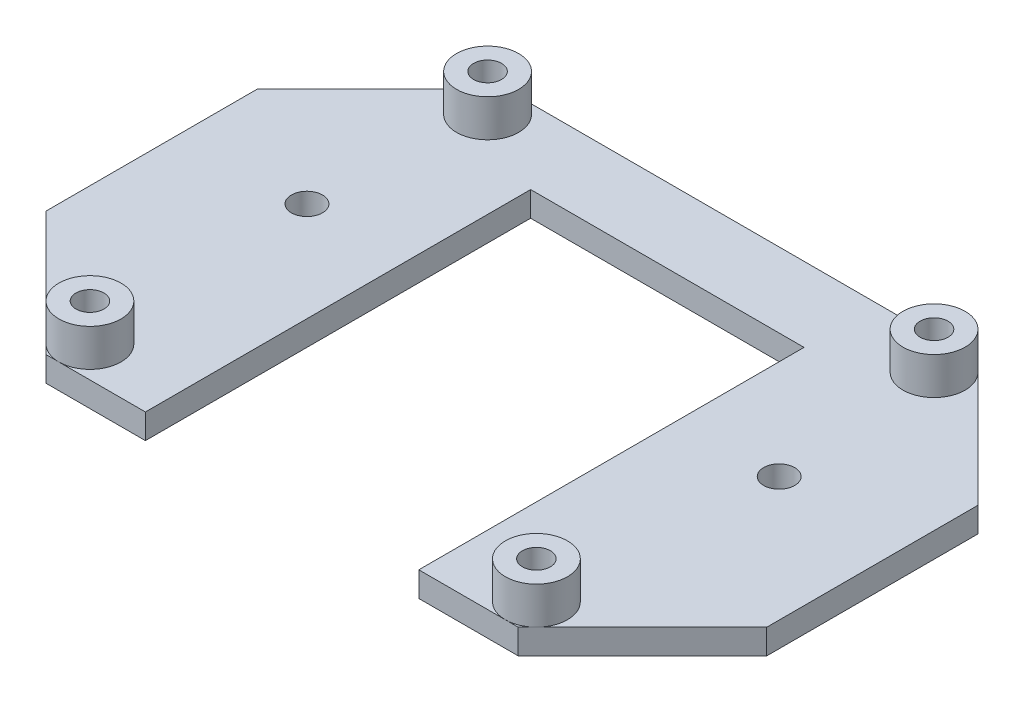
from build123d import *

# Parameters (mm, degrees)
SKETCH1_W           = 116
SKETCH1_H           = 48
BOSS_EXTRUDE1_DEPTH = 4
SKETCH2_R           = 2.5
CUT_EXTRUDE1_DEPTH  = 4
SKETCH3_W           = 44
SKETCH3_H           = 42
CUT_EXTRUDE2_DEPTH  = 4
SKETCH4_W           = 36
SKETCH4_H           = 4
BOSS_EXTRUDE2_DEPTH = 20
SKETCH5_W           = 116
SKETCH5_H           = 4
BOSS_EXTRUDE3_DEPTH = 6
CHAMFER1_SIZE       = 20
SKETCH6_R           = 5
BOSS_EXTRUDE4_DEPTH = 6
SKETCH7_R           = 2.25
CUT_EXTRUDE3_DEPTH  = 10


with BuildPart() as part:
    # Sketch1 → Boss-Extrude1 (new body)
    with BuildSketch(Plane(origin=(0, 0, 0), x_dir=(1, 0, 0), z_dir=(0, 1, 0))):
        Rectangle(SKETCH1_W, SKETCH1_H)
    extrude(amount=BOSS_EXTRUDE1_DEPTH)

    # Sketch2 → Cut-Extrude1 (cut)
    with BuildSketch(Plane(origin=(0, 4, 0), x_dir=(1, 0, 0), z_dir=(0, 1, 0))):
        with Locations(Location((-38, -2, 0), (0, 0, 270))):
            Circle(SKETCH2_R)
        with Locations(Location((38, -2, 0), (0, 0, 270))):
            Circle(SKETCH2_R)
    extrude(amount=-CUT_EXTRUDE1_DEPTH, mode=Mode.SUBTRACT)

    # Sketch3 → Cut-Extrude2 (cut)
    with BuildSketch(Plane(origin=(0, 4, 0), x_dir=(1, 0, 0), z_dir=(0, 1, 0))):
        with Locations((0, -3)):
            Rectangle(SKETCH3_W, SKETCH3_H)
    extrude(amount=-CUT_EXTRUDE2_DEPTH, mode=Mode.SUBTRACT)

    # Sketch4 → Boss-Extrude2 (add)
    with BuildSketch(Plane.XY.offset(24)):
        with Locations((-40, 2)):
            Rectangle(SKETCH4_W, SKETCH4_H)
        with Locations((40, 2)):
            Rectangle(SKETCH4_W, SKETCH4_H)
    extrude(amount=BOSS_EXTRUDE2_DEPTH)

    # Sketch5 → Boss-Extrude3 (add)
    with BuildSketch(Plane(origin=(0, 0, -24), x_dir=(-1, 0, 0), z_dir=(0, 0, -1))):
        with Locations((0, 2)):
            Rectangle(SKETCH5_W, SKETCH5_H)
    extrude(amount=BOSS_EXTRUDE3_DEPTH)

    # Chamfer1
    chamfer1_edges = [part.edges().sort_by_distance(p)[0] for p in [
        (-58, 2, 44),
        (58, 2, 44),
        (58, 2, -30),
        (-58, 2, -30),
    ]]
    chamfer(chamfer1_edges, length=CHAMFER1_SIZE)

    # Sketch6 → Boss-Extrude4 (add)
    with BuildSketch(Plane(origin=(0, 4, 0), x_dir=(1, 0, 0), z_dir=(0, 1, 0))):
        with Locations(Location((-35.928932188, 25, 0), (0, 0, 90))):
            Circle(SKETCH6_R)
        with Locations(Location((35.928932188, 25, 0), (0, 0, 90))):
            Circle(SKETCH6_R)
        with Locations(Location((35.928932188, -39, 0), (0, 0, 270))):
            Circle(SKETCH6_R)
        with Locations(Location((-35.928932188, -39, 0), (0, 0, 270))):
            Circle(SKETCH6_R)
    extrude(amount=BOSS_EXTRUDE4_DEPTH)

    # Sketch7 → Cut-Extrude3 (cut)
    with BuildSketch(Plane(origin=(0, 10, 0), x_dir=(1, 0, 0), z_dir=(0, 1, 0))):
        with Locations(Location((-35.928932188, 25, 0), (0, 0, 270))):
            Circle(SKETCH7_R)
        with Locations(Location((35.928932188, 25, 0), (0, 0, 270))):
            Circle(SKETCH7_R)
        with Locations(Location((35.928932188, -39, 0), (0, 0, 270))):
            Circle(SKETCH7_R)
        with Locations(Location((-35.928932188, -39, 0), (0, 0, 270))):
            Circle(SKETCH7_R)
    extrude(amount=-CUT_EXTRUDE3_DEPTH, mode=Mode.SUBTRACT)


solid = part.part
